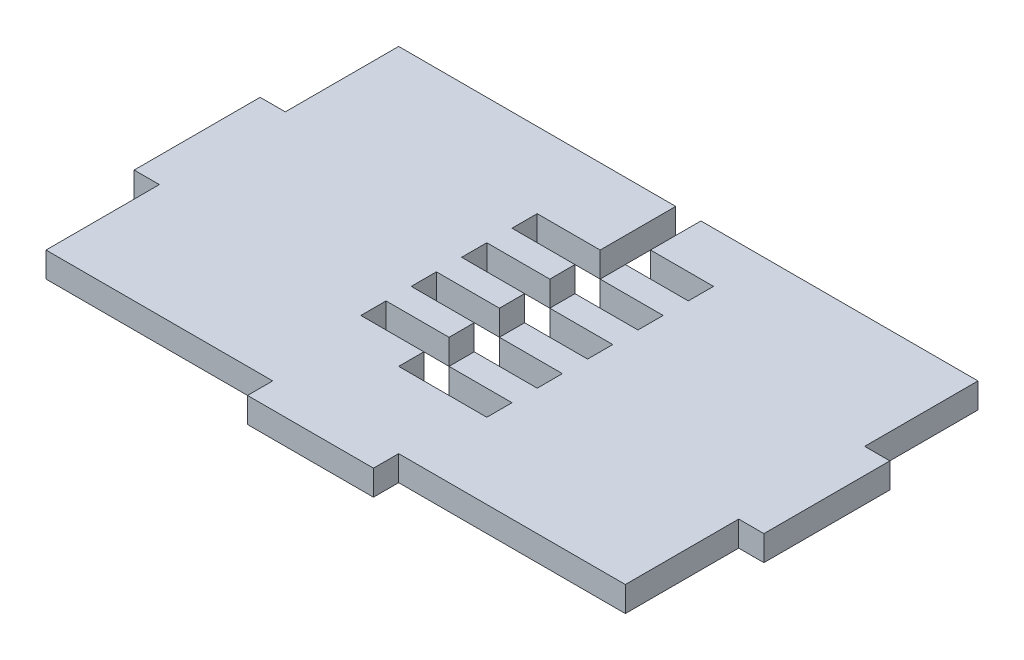
from build123d import *

# Parameters (mm, degrees)
SKETCH_1_W      = 4
SKETCH_1_H      = 20
SKETCH_1_W_2    = 20
SKETCH_1_H_2    = 4
EXTRUDE_2_DEPTH = 4


with BuildPart() as part:
    # 草图1 → 凸台-拉伸2 (new body)
    with BuildSketch(Plane(origin=(0, 0, 0), x_dir=(1, 0, 0), z_dir=(0, 1, 0))):
        Polygon((0, 18), (0, 0), (36, 0), (56, 0), (92, 0), (92, 18), (92, 38), (92, 56), (48, 56), (48, 48), (58, 48), (58, 44), (48, 44), (48, 40), (58, 40), (58, 36), (48, 36), (48, 34), (48, 32), (58, 32), (58, 28), (48, 28), (48, 24), (58, 24), (58, 20), (48, 20), (48, 16), (58, 16), (58, 12), (48, 12), (44, 12), (44, 16), (34, 16), (34, 20), (44, 20), (44, 24), (34, 24), (34, 28), (44, 28), (44, 32), (34, 32), (34, 36), (44, 36), (44, 40), (34, 40), (34, 44), (44, 44), (44, 56), (0, 56), (0, 38), align=None)
        with Locations((-2, 28)):
            Rectangle(SKETCH_1_W, SKETCH_1_H)
        with Locations((46, -2)):
            Rectangle(SKETCH_1_W_2, SKETCH_1_H_2)
        with Locations((94, 28)):
            Rectangle(SKETCH_1_W, SKETCH_1_H)
    extrude(amount=EXTRUDE_2_DEPTH)


solid = part.part
